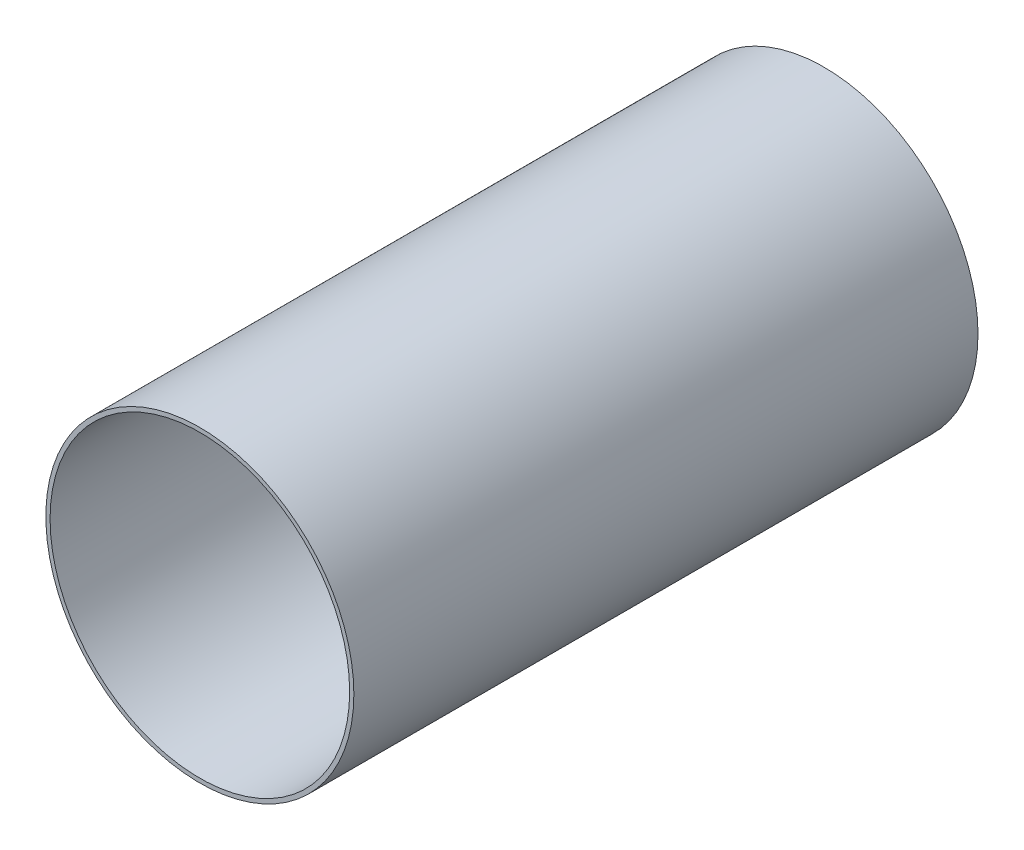
from build123d import *

# Parameters (mm, degrees)
SKETCH1_R           = 49.35
SKETCH1_R_2         = 48
BOSS_EXTRUDE1_DEPTH = 200


with BuildPart() as part:
    # Sketch1 → Boss-Extrude1 (new body)
    with BuildSketch(Plane(origin=(0, 0, 0), x_dir=(0, 1, 0), z_dir=(0, 0, 1))):
        with Locations(Location((0, 0, 0), (0, 0, 270))):
            Circle(SKETCH1_R)
        with Locations(Location((0, 0, 0), (0, 0, 270))):
            Circle(SKETCH1_R_2, mode=Mode.SUBTRACT)
    extrude(amount=BOSS_EXTRUDE1_DEPTH)


solid = part.part
